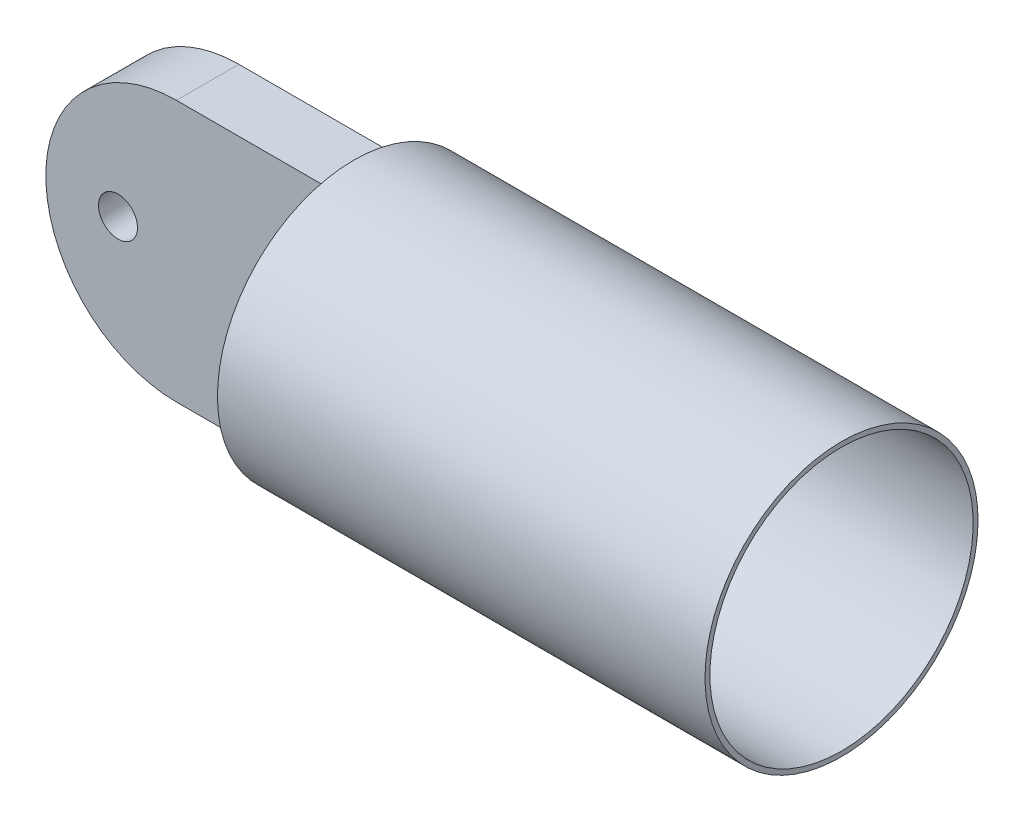
from build123d import *

# Parameters (mm, degrees)
EXTRUDE_1_DEPTH          = 64
CUT_EXTRUDE_1_DEPTH      = 850.57468483
CUT_EXTRUDE_1_DEPTH_BACK = 850.57468483
SKETCH_2_R               = 20
SKETCH_4_R               = 140
EXTRUDE_4_DEPTH          = 500
SHELL_6_T                = -5


with BuildPart() as part:
    # 草图1 → 凸台-拉伸1 (new body)
    with BuildSketch(Plane.XY):
        with BuildLine():
            Line((-567.059552989, 207.601354358), (-417.059552989, 207.601354358))
            Line((-417.059552989, 207.601354358), (-417.059552989, 475.601354358))
            Line((-417.059552989, 475.601354358), (-567.059552989, 475.601354358))
            ThreePointArc((-567.059552989, 475.601354358), (-701.059552989, 341.601354358), (-567.059552989, 207.601354358))
        make_face()
    extrude(amount=EXTRUDE_1_DEPTH)

    # 草图2 → 切除-拉伸1 (cut, two sides: drawn at the far end of the back side and taken through both)
    with BuildSketch(Plane.XY.offset(64).offset(-CUT_EXTRUDE_1_DEPTH_BACK)):
        with Locations((-627.059552989, 342.387508152)):
            Circle(SKETCH_2_R)
    extrude(amount=CUT_EXTRUDE_1_DEPTH + CUT_EXTRUDE_1_DEPTH_BACK, mode=Mode.SUBTRACT)

    # 草图4 → 凸台-拉伸4 (add)
    with BuildSketch(Plane(origin=(-417.059552989, 0, 0), x_dir=(0, 0, -1), z_dir=(1, 0, 0))):
        with Locations(Location((-32, 341.601354358, 0), (0, 0, 90))):
            Circle(SKETCH_4_R)
    extrude(amount=EXTRUDE_4_DEPTH)

    # 抽壳6
    shell_6_openings = [part.faces().sort_by_distance(p)[0] for p in [
        (82.940447011, 341.601354358, 32),
    ]]
    offset(amount=SHELL_6_T, openings=shell_6_openings, kind=Kind.INTERSECTION)


solid = part.part
